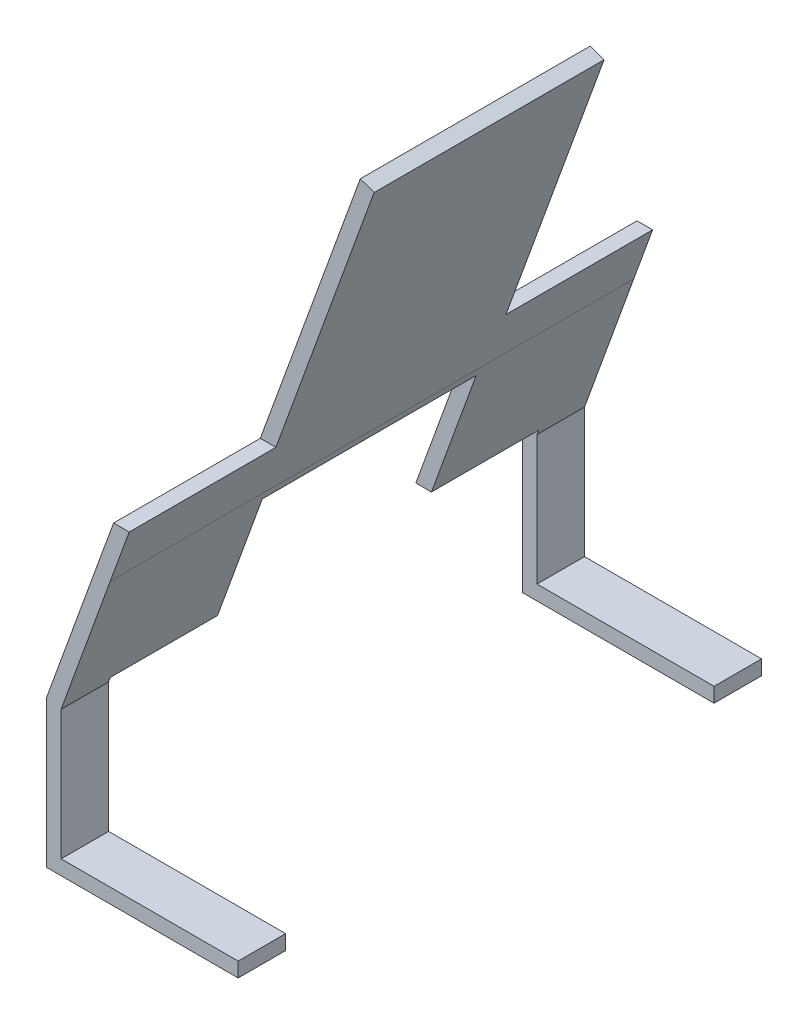
from build123d import *

# Parameters (mm, degrees)
BOSS_EXTRUDE1_DEPTH     = 107
CUT_EXTRUDE1_DEPTH      = 107
CUT_EXTRUDE1_DEPTH_BACK = 107
SKETCH2_W               = 29.989970731
SKETCH2_H               = 56.163122667


with BuildPart() as part:
    # Sketch1 → Boss-Extrude1 (new body)
    with BuildSketch(Plane.XY):
        Polygon((0, 0), (0, 3), (-36.192525263, 3), (-36.192525263, 29.472692743), (-26.142803298, 57.177331674), (-2.201948491, 122.954289658), (-5.021026354, 123.980350088), (-28.962436386, 58.201866633), (-39.192525263, 30), (-39.192525263, 0), align=None)
    extrude(amount=BOSS_EXTRUDE1_DEPTH)

    # Sketch2 → Cut-Extrude1 (cut, two sides: drawn at the far end of the back side and taken through both)
    with BuildSketch(Plane(origin=(0, 0, 0), x_dir=(0, 0, -1), z_dir=(1, 0, 0)).offset(-CUT_EXTRUDE1_DEPTH_BACK)):
        Polygon((-97.288221631, 0), (-97.288221631, 30.429310254), (-75.36242614, 30.429310254), (-75.36242614, 55.650312004), (-31.63757386, 55.650312004), (-31.63757386, 30.429310254), (-9.711778369, 30.429310254), (-9.711778369, 0), align=None)
        with Locations((-92.005014635, 95.898788755)):
            Rectangle(SKETCH2_W, SKETCH2_H)
        with Locations((-14.994985366, 95.898788755)):
            Rectangle(SKETCH2_W, SKETCH2_H)
    extrude(amount=CUT_EXTRUDE1_DEPTH + CUT_EXTRUDE1_DEPTH_BACK, mode=Mode.SUBTRACT)


solid = part.part
